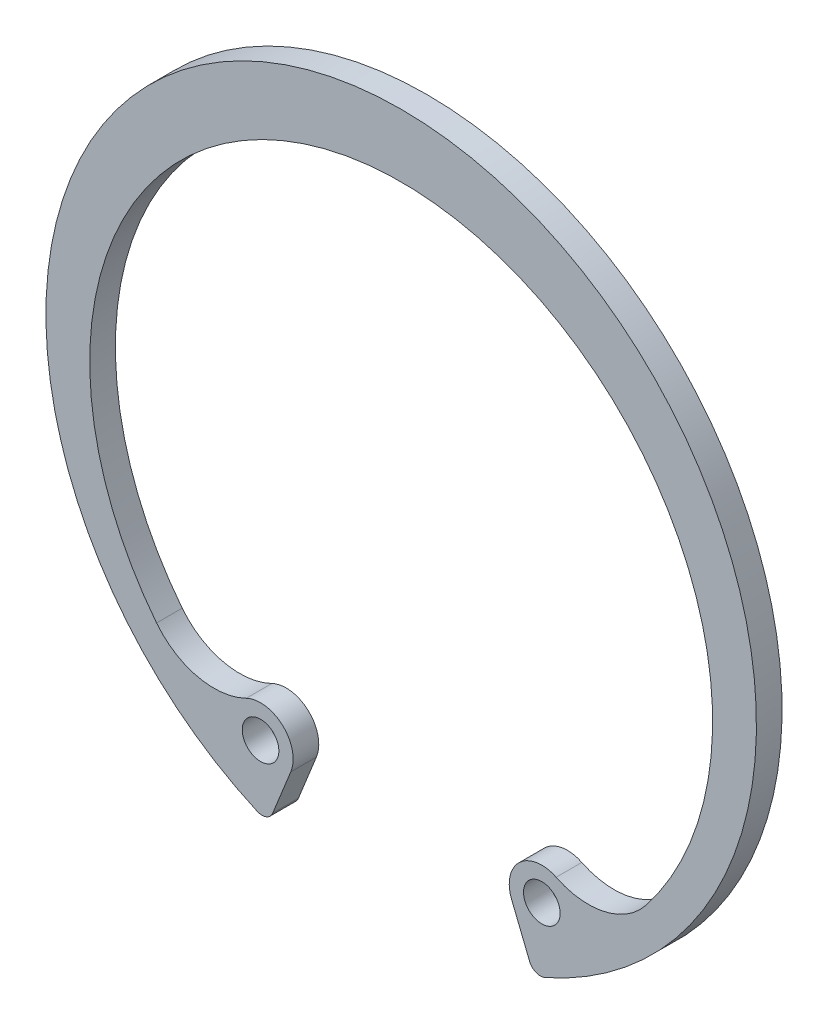
from build123d import *

# Parameters (mm, degrees)
BOSS_EXTRUDE1_DEPTH      = 0.875
BOSS_EXTRUDE1_DEPTH_BACK = 0.875
SKETCH3_R                = 1.25
FILLET1_R                = 0.79375


with BuildPart() as part:
    # Sketch3 → Boss-Extrude1 (new, two sides: drawn at the far end of the back side and taken through both)
    with BuildSketch(Plane.XY.offset(-BOSS_EXTRUDE1_DEPTH_BACK)):
        with BuildLine():
            Line((-7.536269642, -18.690362219), (-9.068559557, -22.490525284))
            ThreePointArc((-9.068559557, -22.490525284), (0, 24.25), (9.068559557, -22.490525284))
            Line((9.068559557, -22.490525284), (7.536269642, -18.690362219))
            ThreePointArc((7.536269642, -18.690362219), (8.084526994, -16.229043526), (10.57907226, -15.860370565))
            ThreePointArc((10.57907226, -15.860370565), (13.884078483, -16.245316894), (16.696841294, -14.467786253))
            ThreePointArc((16.696841294, -14.467786253), (0, 19.95), (-16.696841294, -14.467786253))
            ThreePointArc((-16.696841294, -14.467786253), (-13.884078483, -16.245316894), (-10.57907226, -15.860370565))
            ThreePointArc((-10.57907226, -15.860370565), (-8.084526994, -16.229043526), (-7.536269642, -18.690362219))
        make_face()
        with Locations((-9.599833302, -17.858298507)):
            Circle(SKETCH3_R, mode=Mode.SUBTRACT)
        with Locations(Location((9.599833302, -17.858298507, 0), (0, 0, 180))):
            Circle(SKETCH3_R, mode=Mode.SUBTRACT)
    extrude(amount=BOSS_EXTRUDE1_DEPTH + BOSS_EXTRUDE1_DEPTH_BACK)

    # Fillet1
    fillet1_edges = [part.edges().sort_by_distance(p)[0] for p in [
        (9.068559557, -22.490525284, 0),
        (-9.068559557, -22.490525284, 0),
    ]]
    fillet(fillet1_edges, radius=FILLET1_R)


solid = part.part
